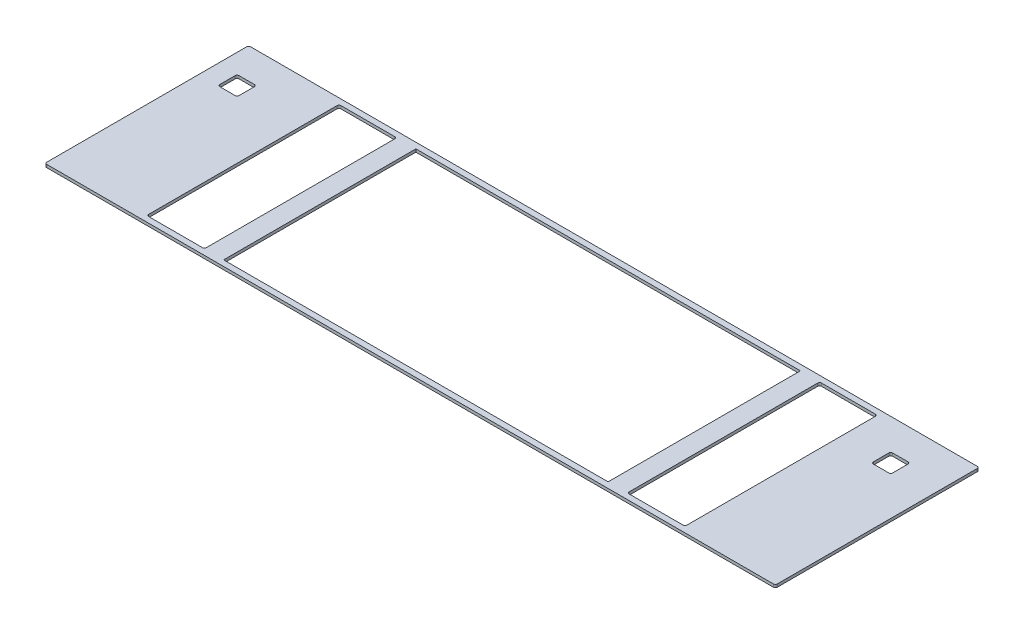
from build123d import *

# Parameters (mm, degrees)
SKETCH_1_W      = 400
SKETCH_1_H      = 200
EXTRUDE_1_DEPTH = 3


with BuildPart() as part:
    # 草图1 → 凸台-拉伸1 (new body)
    with BuildSketch(Plane(origin=(0, 0, 0), x_dir=(1, 0, 0), z_dir=(0, 1, 0))):
        with BuildLine():
            Line((2, 0), (758, 0))
            ThreePointArc((758, 0), (759.414213562, 0.585786438), (760, 2))
            Line((760, 2), (760, 210))
            ThreePointArc((760, 210), (759.414213562, 211.414213562), (758, 212))
            Line((758, 212), (2, 212))
            ThreePointArc((2, 212), (0.585786438, 211.414213562), (0, 210))
            Line((0, 210), (0, 2))
            ThreePointArc((0, 2), (0.585786438, 0.585786438), (2, 0))
        make_face()
        with Locations((380, 106)):
            Rectangle(SKETCH_1_W, SKETCH_1_H, mode=Mode.SUBTRACT)
        with BuildLine():
            Line((658, 6), (602, 6))
            ThreePointArc((602, 6), (600.585786438, 6.585786438), (600, 8))
            Line((600, 8), (600, 204))
            ThreePointArc((600, 204), (600.585786438, 205.414213562), (602, 206))
            Line((602, 206), (658, 206))
            ThreePointArc((658, 206), (659.414213562, 205.414213562), (660, 204))
            Line((660, 204), (660, 8))
            ThreePointArc((660, 8), (659.414213562, 6.585786438), (658, 6))
        make_face(mode=Mode.SUBTRACT)
        with BuildLine():
            Line((158, 6), (102, 6))
            ThreePointArc((102, 6), (100.585786438, 6.585786438), (100, 8))
            Line((100, 8), (100, 204))
            ThreePointArc((100, 204), (100.585786438, 205.414213562), (102, 206))
            Line((102, 206), (158, 206))
            ThreePointArc((158, 206), (159.414213562, 205.414213562), (160, 204))
            Line((160, 204), (160, 8))
            ThreePointArc((160, 8), (159.414213562, 6.585786438), (158, 6))
        make_face(mode=Mode.SUBTRACT)
        with BuildLine():
            Line((38, 160), (22, 160))
            ThreePointArc((22, 160), (20.585786438, 160.585786438), (20, 162))
            Line((20, 162), (20, 178))
            ThreePointArc((20, 178), (20.585786438, 179.414213562), (22, 180))
            Line((22, 180), (38, 180))
            ThreePointArc((38, 180), (39.414213562, 179.414213562), (40, 178))
            Line((40, 178), (40, 162))
            ThreePointArc((40, 162), (39.414213562, 160.585786438), (38, 160))
        make_face(mode=Mode.SUBTRACT)
        with BuildLine():
            Line((718, 160), (702, 160))
            ThreePointArc((702, 160), (700.585786438, 160.585786438), (700, 162))
            Line((700, 162), (700, 178))
            ThreePointArc((700, 178), (700.585786438, 179.414213562), (702, 180))
            Line((702, 180), (718, 180))
            ThreePointArc((718, 180), (719.414213562, 179.414213562), (720, 178))
            Line((720, 178), (720, 162))
            ThreePointArc((720, 162), (719.414213562, 160.585786438), (718, 160))
        make_face(mode=Mode.SUBTRACT)
    extrude(amount=-EXTRUDE_1_DEPTH)


solid = part.part
